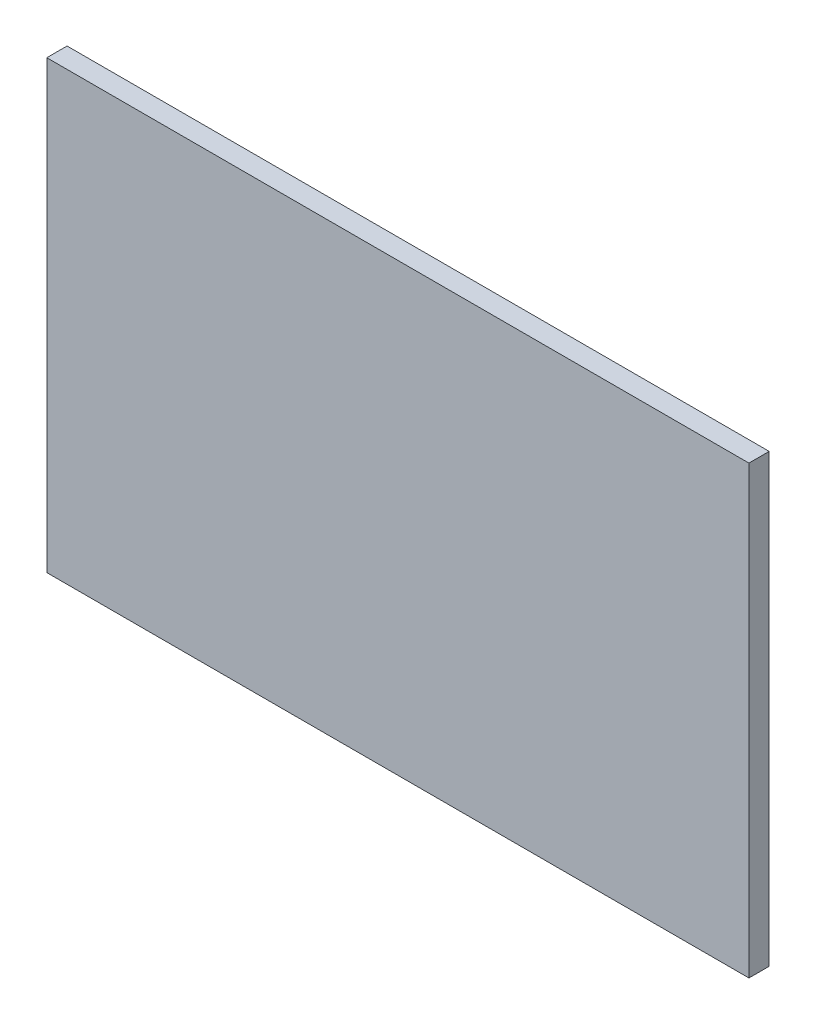
from build123d import *

# Parameters (mm, degrees)
SKETCH1_W           = 219.964
SKETCH1_H           = 139.7
BOSS_EXTRUDE1_DEPTH = 6.35


with BuildPart() as part:
    # Sketch1 → Boss-Extrude1 (new body)
    with BuildSketch(Plane.XY):
        Rectangle(SKETCH1_W, SKETCH1_H)
    extrude(amount=BOSS_EXTRUDE1_DEPTH)


solid = part.part
